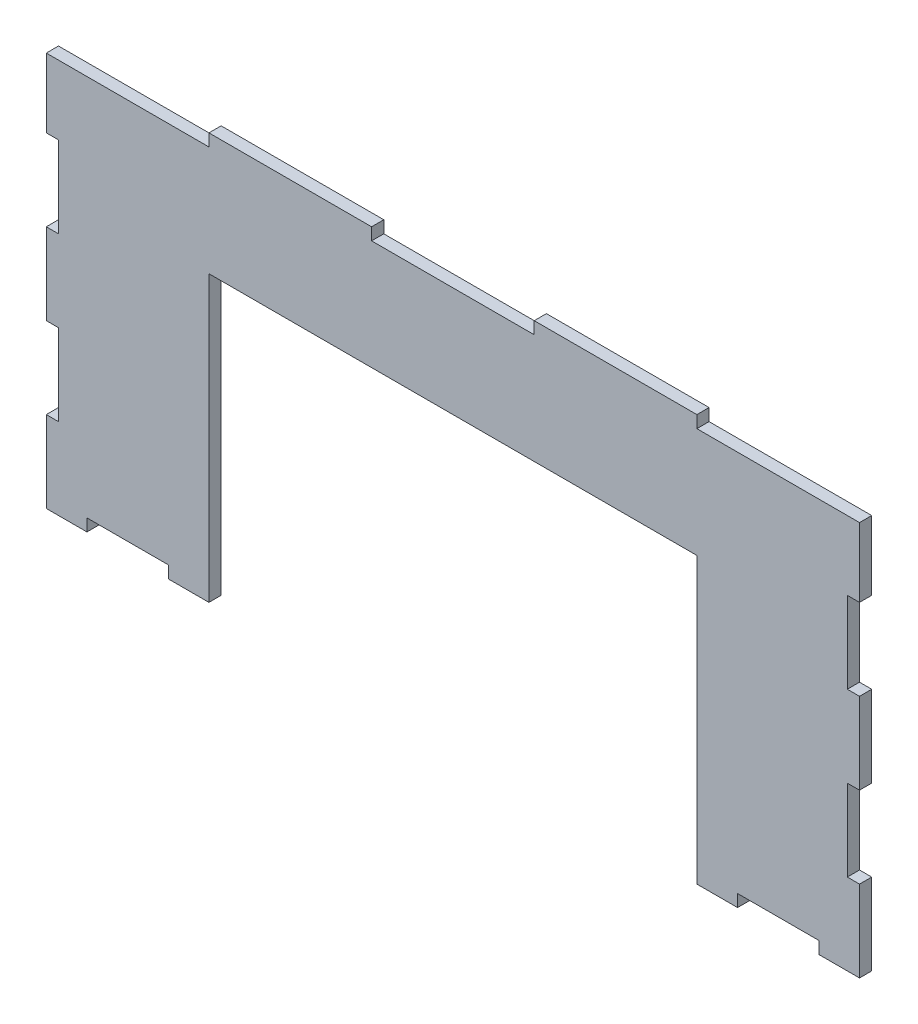
from build123d import *

# Parameters (mm, degrees)
BOSS_EXTRUDE1_DEPTH = 3
SKETCH2_W           = 3
SKETCH2_H           = 20
SKETCH2_W_2         = 40
SKETCH2_H_2         = 3
CUT_EXTRUDE1_DEPTH  = 3


with BuildPart() as part:
    # Sketch1 → Boss-Extrude1 (new body)
    with BuildSketch(Plane.XY):
        Polygon((-60, 5.09773753), (-60, -50), (-70, -50), (-70, -47), (-90, -47), (-90, -50), (-100, -50), (-100, 50), (100, 50), (100, -50), (90, -50), (90, -47), (70, -47), (70, -50), (60, -50), (60, -40.178411678), (60, 20), (-60, 20), align=None)
    extrude(amount=BOSS_EXTRUDE1_DEPTH)

    # Sketch2 → Cut-Extrude1 (cut)
    with BuildSketch(Plane.XY.offset(3)):
        with Locations((-98.5, -20)):
            Rectangle(SKETCH2_W, SKETCH2_H)
        with Locations((-98.5, 20)):
            Rectangle(SKETCH2_W, SKETCH2_H)
        with Locations((0, 48.5)):
            Rectangle(SKETCH2_W_2, SKETCH2_H_2)
        with Locations((80, 48.5)):
            Rectangle(SKETCH2_W_2, SKETCH2_H_2)
        with Locations((98.5, 20)):
            Rectangle(SKETCH2_W, SKETCH2_H)
        with Locations((98.5, -20)):
            Rectangle(SKETCH2_W, SKETCH2_H)
        with Locations((-80, 48.5)):
            Rectangle(SKETCH2_W_2, SKETCH2_H_2)
    extrude(amount=-CUT_EXTRUDE1_DEPTH, mode=Mode.SUBTRACT)


solid = part.part
